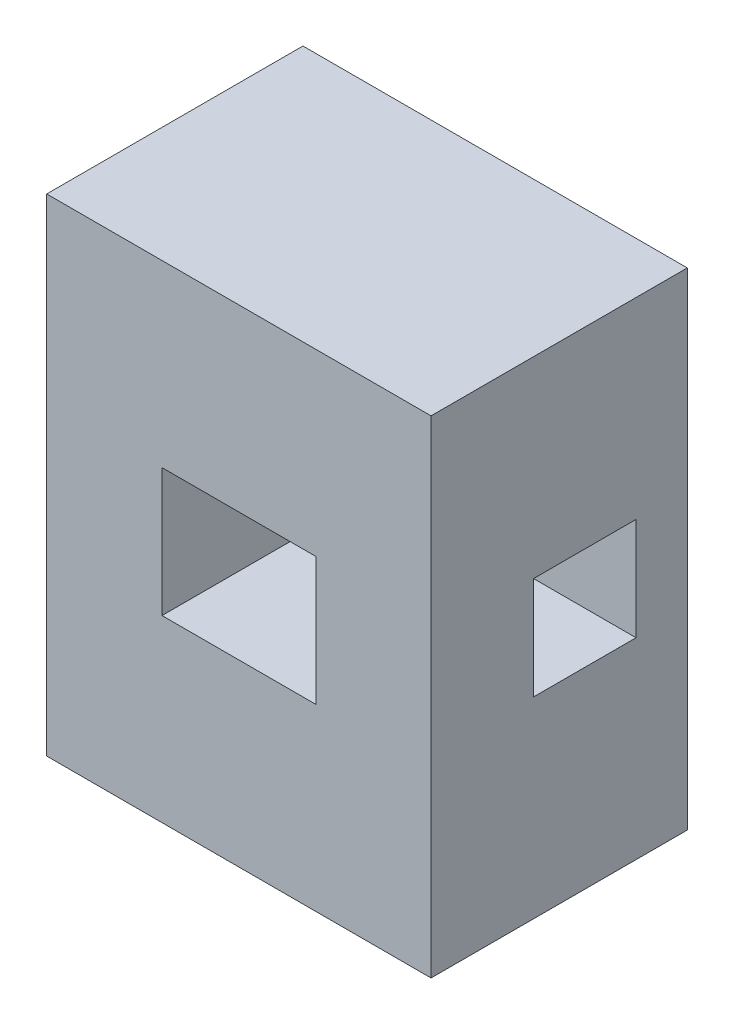
from build123d import *

# Parameters (mm, degrees)
SKETCH1_W           = 30
SKETCH1_H           = 20
BOSS_EXTRUDE1_DEPTH = 38
SKETCH2_W           = 12
SKETCH2_H           = 10
CUT_EXTRUDE1_DEPTH  = 38
SKETCH3_W           = 8
SKETCH3_H           = 8
CUT_EXTRUDE2_DEPTH  = 9
SKETCH4_W           = 2
SKETCH4_H           = 10
BOSS_EXTRUDE2_DEPTH = 12


with BuildPart() as part:
    # Sketch1 → Boss-Extrude1 (new body)
    with BuildSketch(Plane(origin=(0, 0, 0), x_dir=(1, 0, 0), z_dir=(0, 1, 0))):
        with Locations((15, 10)):
            Rectangle(SKETCH1_W, SKETCH1_H)
    extrude(amount=BOSS_EXTRUDE1_DEPTH)

    # Sketch2 → Cut-Extrude1 (cut)
    with BuildSketch(Plane.XY):
        with Locations((15, 19)):
            Rectangle(SKETCH2_W, SKETCH2_H)
    extrude(amount=-CUT_EXTRUDE1_DEPTH, mode=Mode.SUBTRACT)

    # Sketch3 → Cut-Extrude2 (cut)
    with BuildSketch(Plane(origin=(30, 0, 0), x_dir=(0, 0, -1), z_dir=(1, 0, 0))):
        with Locations((12, 19)):
            Rectangle(SKETCH3_W, SKETCH3_H)
    extrude(amount=-CUT_EXTRUDE2_DEPTH, mode=Mode.SUBTRACT)

    # Sketch4 → Boss-Extrude2 (add)
    with BuildSketch(Plane.ZY.offset(-21)):
        with Locations((-19, 19)):
            Rectangle(SKETCH4_W, SKETCH4_H)
    extrude(amount=BOSS_EXTRUDE2_DEPTH)


solid = part.part
